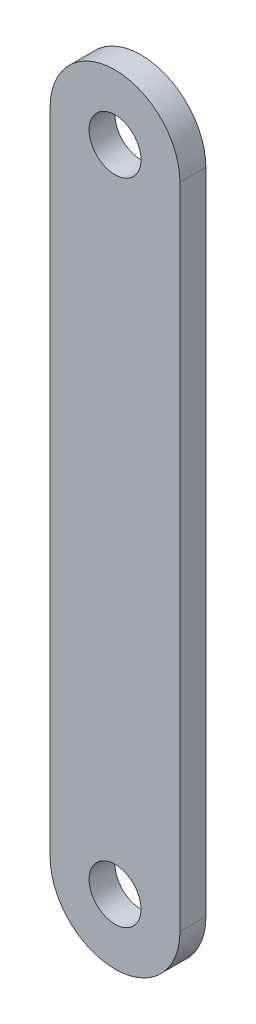
from build123d import *

# Parameters (mm, degrees)
SKETCH_1_R      = 2
EXTRUDE_1_DEPTH = 2


with BuildPart() as part:
    # 草图1 → 凸台-拉伸1 (new body)
    with BuildSketch(Plane.XY):
        with BuildLine():
            Line((-5, 25), (-5, -25))
            ThreePointArc((-5, -25), (0, -30), (5, -25))
            Line((5, -25), (5, 25))
            ThreePointArc((5, 25), (0, 30), (-5, 25))
        make_face()
        with Locations((0, -25)):
            Circle(SKETCH_1_R, mode=Mode.SUBTRACT)
        with Locations((0, 25)):
            Circle(SKETCH_1_R, mode=Mode.SUBTRACT)
    extrude(amount=EXTRUDE_1_DEPTH)


solid = part.part
